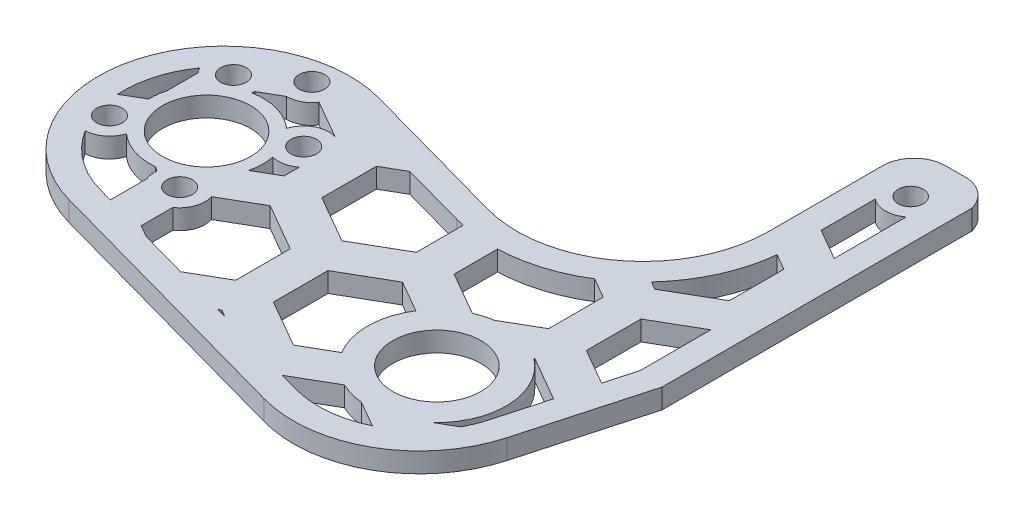
from build123d import *

# Parameters (mm, degrees)
SKETCH1_R           = 7
SKETCH1_R_2         = 2.025
SKETCH1_R_3         = 2.05
BOSS_EXTRUDE1_DEPTH = 3.15
CUT_EXTRUDE1_DEPTH  = 3.15
BOSS_EXTRUDE2_START = -3.15
SKETCH3_R           = 2
SKETCH3_R_2         = 7
SKETCH3_R_3         = 2.025
SKETCH3_R_4         = 11
BOSS_EXTRUDE2_DEPTH = 3.15


with BuildPart() as part:
    # Sketch1 → Boss-Extrude1 (new body)
    with BuildSketch(Plane(origin=(0, 0, 0), x_dir=(1, 0, 0), z_dir=(0, 1, 0))):
        with BuildLine():
            Line((51.028117024, 31.392984288), (48.107015586, 31.392984288))
            ThreePointArc((48.107015586, 31.392984288), (44.57148168, 29.928518194), (43.107015586, 26.392984288))
            Line((43.107015586, 26.392984288), (43.107015586, 8.3528051))
            ThreePointArc((43.107015586, 8.3528051), (35.212895347, -7.567234951), (17.762248065, -10.919803965))
            Line((17.762248065, -10.919803965), (-6.126047208, -4.29499337))
            ThreePointArc((-6.126047208, -4.29499337), (-21.319285931, -6.160488515), (-30.743423793, -18.222834912))
            ThreePointArc((-30.743423793, -18.222834912), (-28.877928648, -33.416073636), (-16.815582251, -42.840211498))
            Line((-16.815582251, -42.840211498), (26.065972917, -54.732319234))
            ThreePointArc((26.065972917, -54.732319234), (41.259211641, -52.866824088), (50.683349503, -40.804477691))
            Line((50.683349503, -40.804477691), (56.028117024, -21.531868627))
            Line((56.028117024, -21.531868627), (56.028117024, 26.392984288))
            ThreePointArc((56.028117024, 26.392984288), (54.56365093, 29.928518194), (51.028117024, 31.392984288))
        make_face()
        with Locations(Location((35.265262251, -36.528663674, 0), (0, 0, 270))):
            Circle(SKETCH1_R, mode=Mode.SUBTRACT)
        with Locations(Location((-15.325336542, -22.49864893, 0), (0, 0, 270))):
            Circle(SKETCH1_R, mode=Mode.SUBTRACT)
        with Locations(Location((-5.478385908, -16.927512313, 0), (0, 0, 270))):
            Circle(SKETCH1_R_2, mode=Mode.SUBTRACT)
        with Locations(Location((-9.754199925, -32.345599564, 0), (0, 0, 270))):
            Circle(SKETCH1_R_2, mode=Mode.SUBTRACT)
        with Locations(Location((-25.172287176, -28.069785547, 0), (0, 0, 270))):
            Circle(SKETCH1_R_2, mode=Mode.SUBTRACT)
        with Locations(Location((-20.896473159, -12.651698295, 0), (0, 0, 270))):
            Circle(SKETCH1_R_2, mode=Mode.SUBTRACT)
        with Locations(Location((-13.725837034, -7.376096191, 0), (0, 0, 270))):
            Circle(SKETCH1_R_2, mode=Mode.SUBTRACT)
        with Locations(Location((49.567566305, 24.392984288, 0), (0, 0, 270))):
            Circle(SKETCH1_R_3, mode=Mode.SUBTRACT)
    extrude(amount=BOSS_EXTRUDE1_DEPTH)

    # Sketch2 → Cut-Extrude1 (cut)
    with BuildSketch(Plane(origin=(0, 3.15, 0), x_dir=(1, 0, 0), z_dir=(0, 1, 0))):
        Polygon((0, 8.660254038), (-7.5, 4.330127019), (-7.5, -4.330127019), (0, -8.660254038), (7.5, -4.330127019), (7.5, 4.330127019), align=None)
        Polygon((21, 8.660254038), (13.5, 4.330127019), (13.5, -4.330127019), (21, -8.660254038), (28.5, -4.330127019), (28.5, 4.330127019), align=None)
        Polygon((10.5, -9.526279442), (3, -13.856406461), (3, -22.516660498), (10.5, -26.846787517), (18, -22.516660498), (18, -13.856406461), align=None)
        Polygon((31.5, -9.526279442), (24, -13.856406461), (24, -22.516660498), (31.5, -26.846787517), (39, -22.516660498), (39, -13.856406461), align=None)
        Polygon((52.5, -9.526279442), (45, -13.856406461), (45, -22.516660498), (52.5, -26.846787517), (60, -22.516660498), (60, -13.856406461), align=None)
        Polygon((42, 8.660254038), (34.5, 4.330127019), (34.5, -4.330127019), (42, -8.660254038), (49.5, -4.330127019), (49.5, 4.330127019), align=None)
        Polygon((63, 8.660254038), (55.5, 4.330127019), (55.5, -4.330127019), (63, -8.660254038), (70.5, -4.330127019), (70.5, 4.330127019), align=None)
        Polygon((73.5, -9.526279442), (66, -13.856406461), (66, -22.516660498), (73.5, -26.846787517), (81, -22.516660498), (81, -13.856406461), align=None)
        Polygon((52.5, -45.899346401), (45, -50.229473419), (45, -58.889727457), (52.5, -63.219854476), (60, -58.889727457), (60, -50.229473419), align=None)
        Polygon((42, -27.712812921), (34.5, -32.04293994), (34.5, -40.703193978), (42, -45.033320997), (49.5, -40.703193978), (49.5, -32.04293994), align=None)
        Polygon((63, -27.712812921), (55.5, -32.04293994), (55.5, -40.703193978), (63, -45.033320997), (70.5, -40.703193978), (70.5, -32.04293994), align=None)
        Polygon((73.5, -45.899346401), (66, -50.229473419), (66, -58.889727457), (73.5, -63.219854476), (81, -58.889727457), (81, -50.229473419), align=None)
        Polygon((10.5, -45.899346401), (3, -50.229473419), (3, -58.889727457), (10.5, -63.219854476), (18, -58.889727457), (18, -50.229473419), align=None)
        Polygon((0, -27.712812921), (-7.5, -32.04293994), (-7.5, -40.703193978), (0, -45.033320997), (7.5, -40.703193978), (7.5, -32.04293994), align=None)
        Polygon((21, -27.712812921), (13.5, -32.04293994), (13.5, -40.703193978), (21, -45.033320997), (28.5, -40.703193978), (28.5, -32.04293994), align=None)
        Polygon((31.5, -45.899346401), (24, -50.229473419), (24, -58.889727457), (31.5, -63.219854476), (39, -58.889727457), (39, -50.229473419), align=None)
        Polygon((-21, -27.712812921), (-28.5, -32.04293994), (-28.5, -40.703193978), (-21, -45.033320997), (-13.5, -40.703193978), (-13.5, -32.04293994), align=None)
        Polygon((-10.5, -9.526279442), (-18, -13.856406461), (-18, -22.516660498), (-10.5, -26.846787517), (-3, -22.516660498), (-3, -13.856406461), align=None)
        Polygon((-21, 8.660254038), (-28.5, 4.330127019), (-28.5, -4.330127019), (-21, -8.660254038), (-13.5, -4.330127019), (-13.5, 4.330127019), align=None)
        Polygon((-10.5, -45.899346401), (-18, -50.229473419), (-18, -58.889727457), (-10.5, -63.219854476), (-3, -58.889727457), (-3, -50.229473419), align=None)
        Polygon((-42, -27.712812921), (-49.5, -32.04293994), (-49.5, -40.703193978), (-42, -45.033320997), (-34.5, -40.703193978), (-34.5, -32.04293994), align=None)
        Polygon((-31.5, -9.526279442), (-39, -13.856406461), (-39, -22.516660498), (-31.5, -26.846787517), (-24, -22.516660498), (-24, -13.856406461), align=None)
        Polygon((-42, 8.660254038), (-49.5, 4.330127019), (-49.5, -4.330127019), (-42, -8.660254038), (-34.5, -4.330127019), (-34.5, 4.330127019), align=None)
        Polygon((-31.5, -45.899346401), (-39, -50.229473419), (-39, -58.889727457), (-31.5, -63.219854476), (-24, -58.889727457), (-24, -50.229473419), align=None)
        Polygon((42, 45.033320997), (34.5, 40.703193978), (34.5, 32.04293994), (42, 27.712812921), (49.5, 32.04293994), (49.5, 40.703193978), align=None)
        Polygon((63, 45.033320997), (55.5, 40.703193978), (55.5, 32.04293994), (63, 27.712812921), (70.5, 32.04293994), (70.5, 40.703193978), align=None)
        Polygon((73.5, 26.846787517), (66, 22.516660498), (66, 13.856406461), (73.5, 9.526279442), (81, 13.856406461), (81, 22.516660498), align=None)
        Polygon((52.5, 26.846787517), (45, 22.516660498), (45, 13.856406461), (52.5, 9.526279442), (60, 13.856406461), (60, 22.516660498), align=None)
    extrude(amount=-CUT_EXTRUDE1_DEPTH, mode=Mode.SUBTRACT)

    # Sketch3 → Boss-Extrude2 (add)
    # profile 1 of 2: a face of its own
    with BuildSketch(Plane(origin=(0, 3.15, 0), x_dir=(1, 0, 0), z_dir=(0, 1, 0)).offset(BOSS_EXTRUDE2_START)):
        with BuildLine():
            Line((50.793806272, 31.392984288), (48.107015586, 31.392984288))
            ThreePointArc((48.107015586, 31.392984288), (44.57148168, 29.928518194), (43.107015586, 26.392984288))
            Line((43.107015586, 26.392984288), (43.107015586, 8.3528051))
            ThreePointArc((43.107015586, 8.3528051), (35.212895347, -7.567234951), (17.762248065, -10.919803965))
            Line((17.762248065, -10.919803965), (-6.126047208, -4.29499337))
            ThreePointArc((-6.126047208, -4.29499337), (-20.562647206, -5.753602821), (-30.213693877, -16.588742838))
            ThreePointArc((-30.213693877, -16.588742838), (-29.284814342, -32.659434911), (-16.815582251, -42.840211498))
            Line((-16.815582251, -42.840211498), (26.065972917, -54.732319234))
            ThreePointArc((26.065972917, -54.732319234), (41.259211641, -52.866824088), (50.683349503, -40.804477691))
            Line((50.683349503, -40.804477691), (56.028117024, -21.531868627))
            Line((56.028117024, -21.531868627), (56.028117024, 27.690214825))
            ThreePointArc((56.028117024, 27.690214825), (54.073099239, 30.477610817), (50.793806272, 31.392984288))
        make_face()
        with Locations(Location((49.567566305, 24.392984288, 0), (0, 0, 270))):
            Circle(SKETCH3_R, mode=Mode.SUBTRACT)
        with Locations(Location((-15.325336542, -22.49864893, 0), (0, 0, 270))):
            Circle(SKETCH3_R_2, mode=Mode.SUBTRACT)
        with Locations(Location((-20.896473159, -12.651698295, 0), (0, 0, 270))):
            Circle(SKETCH3_R_3, mode=Mode.SUBTRACT)
        with Locations(Location((-13.725837034, -7.376096191, 0), (0, 0, 270))):
            Circle(SKETCH3_R_3, mode=Mode.SUBTRACT)
        with Locations(Location((-25.172287176, -28.069785547, 0), (0, 0, 270))):
            Circle(SKETCH3_R_3, mode=Mode.SUBTRACT)
        with Locations(Location((-9.754199925, -32.345599564, 0), (0, 0, 270))):
            Circle(SKETCH3_R_3, mode=Mode.SUBTRACT)
        with Locations(Location((-5.478385908, -16.927512313, 0), (0, 0, 270))):
            Circle(SKETCH3_R_3, mode=Mode.SUBTRACT)
        with BuildLine():
            Line((47.107015586, 21.239305458), (47.107015586, 8.3528051))
            ThreePointArc((47.107015586, 8.3528051), (37.634071299, -10.751242961), (16.69329456, -14.774325777))
            Line((16.69329456, -14.774325777), (-7.195000712, -8.149515183))
            ThreePointArc((-7.195000712, -8.149515183), (-8.443375133, -7.856631443), (-9.711193989, -7.66465507))
            ThreePointArc((-9.711193989, -7.66465507), (-13.17062628, -11.36261924), (-17.508855114, -8.750650375))
            ThreePointArc((-17.508855114, -8.750650375), (-18.103373072, -9.007067766), (-18.687030177, -9.287328115))
            ThreePointArc((-18.687030177, -9.287328115), (-17.142141715, -11.200622691), (-16.998671761, -13.655575412))
            ThreePointArc((-16.998671761, -13.655575412), (-12.920191157, -13.825974851), (-9.336488748, -15.780486823))
            ThreePointArc((-9.336488748, -15.780486823), (-1.975204232, -14.945507483), (-6.482263024, -20.82531371))
            ThreePointArc((-6.482263024, -20.82531371), (-6.652662463, -24.903794314), (-8.607174435, -28.487496724))
            ThreePointArc((-8.607174435, -28.487496724), (-7.772195096, -35.84878124), (-13.652001323, -31.341722448))
            ThreePointArc((-13.652001323, -31.341722448), (-17.730481927, -31.171323009), (-21.314184336, -29.216811037))
            ThreePointArc((-21.314184336, -29.216811037), (-22.701556213, -31.247223745), (-25.01120364, -32.091560913))
            ThreePointArc((-25.01120364, -32.091560913), (-21.022595954, -36.403625004), (-15.746628746, -38.985689685))
            Line((-15.746628746, -38.985689685), (27.134926421, -50.877797421))
            ThreePointArc((27.134926421, -50.877797421), (39.2895174, -49.385401305), (46.82882769, -39.735524187))
            Line((46.82882769, -39.735524187), (52.028117024, -20.987492519))
            Line((52.028117024, -20.987492519), (52.028117024, 21.239305458))
            ThreePointArc((52.028117024, 21.239305458), (49.567566305, 20.392984288), (47.107015586, 21.239305458))
        make_face(mode=Mode.SUBTRACT)
        with BuildLine():
            ThreePointArc((-26.465118047, -17.984514757), (-27.31052728, -21.308508299), (-27.428073888, -24.736311186))
            ThreePointArc((-27.428073888, -24.736311186), (-25.8588989, -24.103781344), (-24.16841006, -24.171984149))
            ThreePointArc((-24.16841006, -24.171984149), (-23.998010621, -20.093503545), (-22.043498649, -16.509801136))
            ThreePointArc((-22.043498649, -16.509801136), (-23.527657447, -15.697596232), (-24.546925983, -14.34722747))
            ThreePointArc((-24.546925983, -14.34722747), (-25.623358962, -16.103991261), (-26.465118047, -17.984514757))
        make_face(mode=Mode.SUBTRACT)
    # profile 2 of 2: a face of its own
    with BuildSketch(Plane(origin=(0, 3.15, 0), x_dir=(1, 0, 0), z_dir=(0, 1, 0)).offset(BOSS_EXTRUDE2_START)):
        with Locations((35.265262251, -36.528663674)):
            Circle(SKETCH3_R_4)
        with Locations(Location((35.265262251, -36.528663674, 0), (0, 0, 270))):
            Circle(SKETCH3_R_2, mode=Mode.SUBTRACT)
    extrude(amount=BOSS_EXTRUDE2_DEPTH)


solid = part.part
